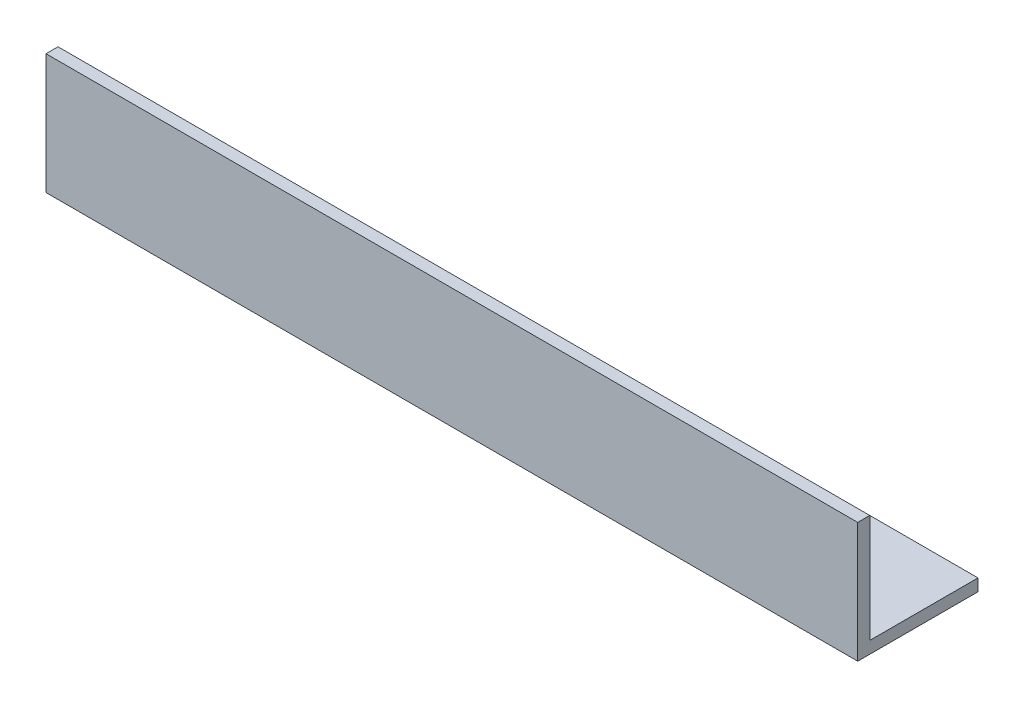
from build123d import *

# Parameters (mm, degrees)
BOSS_EXTRUDE1_DEPTH = 135
SKETCH2_R           = 2.5
CUT_EXTRUDE1_DEPTH  = 2


with BuildPart() as part:
    # Sketch1 → Boss-Extrude1 (new body)
    with BuildSketch(Plane(origin=(0, 0, 0), x_dir=(0, 0, -1), z_dir=(1, 0, 0))):
        Polygon((0, 20), (0, 0), (20, 0), (20, 2), (2, 2), (2, 20), align=None)
    extrude(amount=BOSS_EXTRUDE1_DEPTH)

    # Sketch2 → Cut-Extrude1 (cut)
    with BuildSketch(Plane(origin=(0, 2, 0), x_dir=(1, 0, 0), z_dir=(0, 1, 0))):
        with Locations(Location((8, 11, 0), (0, 0, 270))):
            Circle(SKETCH2_R)
        with Locations(Location((30, 11, 0), (0, 0, 270))):
            Circle(SKETCH2_R)
    extrude(amount=-CUT_EXTRUDE1_DEPTH, mode=Mode.SUBTRACT)


solid = part.part
